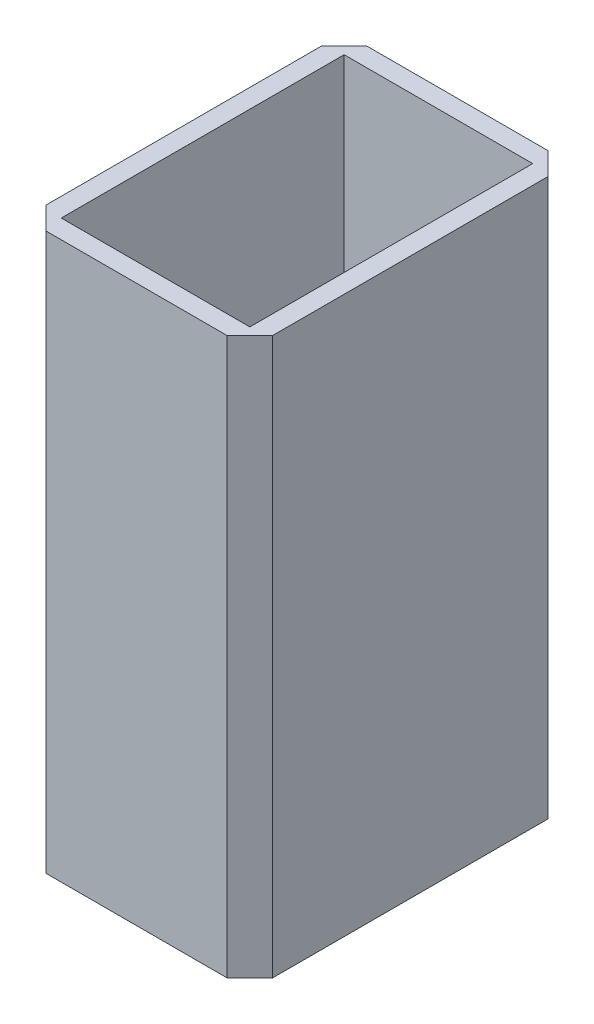
from build123d import *

# Parameters (mm, degrees)
SKETCH1_W           = 38.1
SKETCH1_H           = 53.975
BOSS_EXTRUDE1_DEPTH = 3.175
SKETCH2_W           = 38.1
SKETCH2_H           = 53.975
SKETCH2_W_2         = 31.75
SKETCH2_H_2         = 47.625
BOSS_EXTRUDE2_DEPTH = 90.4875
CHAMFER1_SIZE       = 3.81


with BuildPart() as part:
    # Sketch1 → Boss-Extrude1 (new body)
    with BuildSketch(Plane(origin=(0, 0, 0), x_dir=(1, 0, 0), z_dir=(0, 1, 0))):
        with Locations((-33.545007613, -37.607739585)):
            Rectangle(SKETCH1_W, SKETCH1_H)
    extrude(amount=BOSS_EXTRUDE1_DEPTH)

    # Sketch2 → Boss-Extrude2 (add)
    with BuildSketch(Plane(origin=(0, 3.175, 0), x_dir=(1, 0, 0), z_dir=(0, 1, 0))):
        with Locations((-33.545007613, -37.607739585)):
            Rectangle(SKETCH2_W, SKETCH2_H)
        with Locations((-33.545007613, -37.607739585)):
            Rectangle(SKETCH2_W_2, SKETCH2_H_2, mode=Mode.SUBTRACT)
    extrude(amount=BOSS_EXTRUDE2_DEPTH)

    # Chamfer1
    chamfer1_edges = [part.edges().sort_by_distance(p)[0] for p in [
        (-52.595007613, 46.83125, 10.620239585),
        (-14.495007613, 46.83125, 10.620239585),
        (-14.495007613, 46.83125, 64.595239585),
        (-52.595007613, 46.83125, 64.595239585),
    ]]
    chamfer(chamfer1_edges, length=CHAMFER1_SIZE)


solid = part.part
